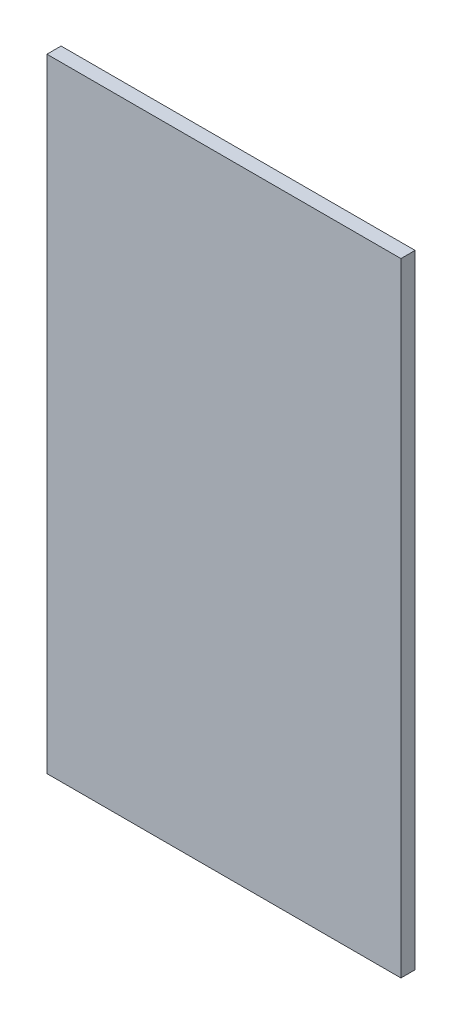
from build123d import *

# Parameters (mm, degrees)
SKETCH1_W           = 150
SKETCH1_H           = 264
BOSS_EXTRUDE1_DEPTH = 6


with BuildPart() as part:
    # Sketch1 → Boss-Extrude1 (new body)
    with BuildSketch(Plane.XY):
        with Locations((46.428571429, 109.104761905)):
            Rectangle(SKETCH1_W, SKETCH1_H)
    extrude(amount=BOSS_EXTRUDE1_DEPTH)


solid = part.part
